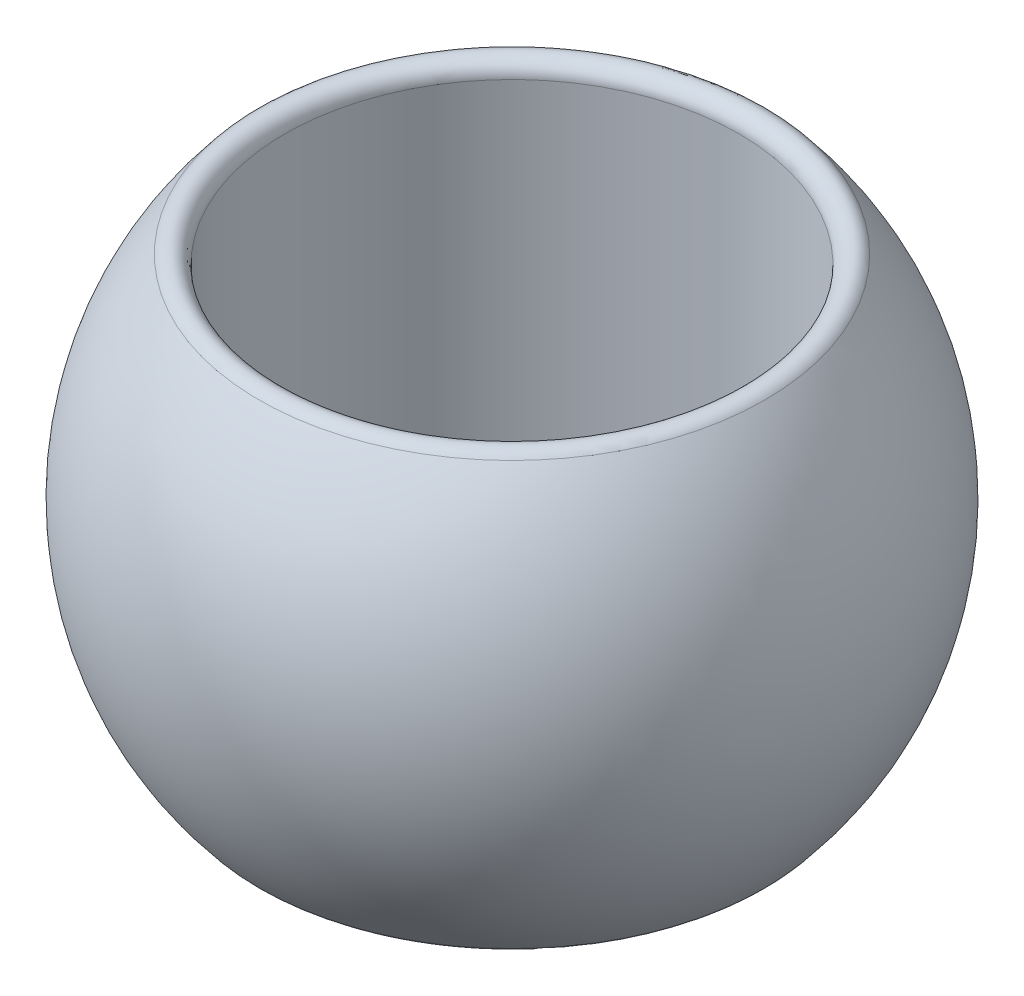
from build123d import *

# Parameters (mm, degrees)
CUT_EXTRUDE1_DEPTH      = 10
CUT_EXTRUDE1_DEPTH_BACK = 10
SKETCH2_R               = 3.1
FILLET1_R               = 0.2


with BuildPart() as part:
    # Sketch1 → Revolve1 (revolve)
    with BuildSketch(Plane.XY):
        with BuildLine():
            Line((0, 4.5), (0, -4.5))
            ThreePointArc((0, -4.5), (4.5, 0), (0, 4.5))
        make_face()
    revolve(axis=Axis((0, 4.5, 0), (0, -1, 0)))

    # Sketch2 → Cut-Extrude1 (cut, two sides: drawn at the far end of the back side and taken through both)
    with BuildSketch(Plane(origin=(0, 0, 0), x_dir=(1, 0, 0), z_dir=(0, 1, 0)).offset(-CUT_EXTRUDE1_DEPTH_BACK)):
        Circle(SKETCH2_R)
    extrude(amount=CUT_EXTRUDE1_DEPTH + CUT_EXTRUDE1_DEPTH_BACK, mode=Mode.SUBTRACT)

    # Fillet1
    fillet1_edges = [part.edges().sort_by_distance(p)[0] for p in [
        (-3.1, 3.261901286, 0),
        (-3.1, -3.261901286, 0),
    ]]
    fillet(fillet1_edges, radius=FILLET1_R)


solid = part.part
